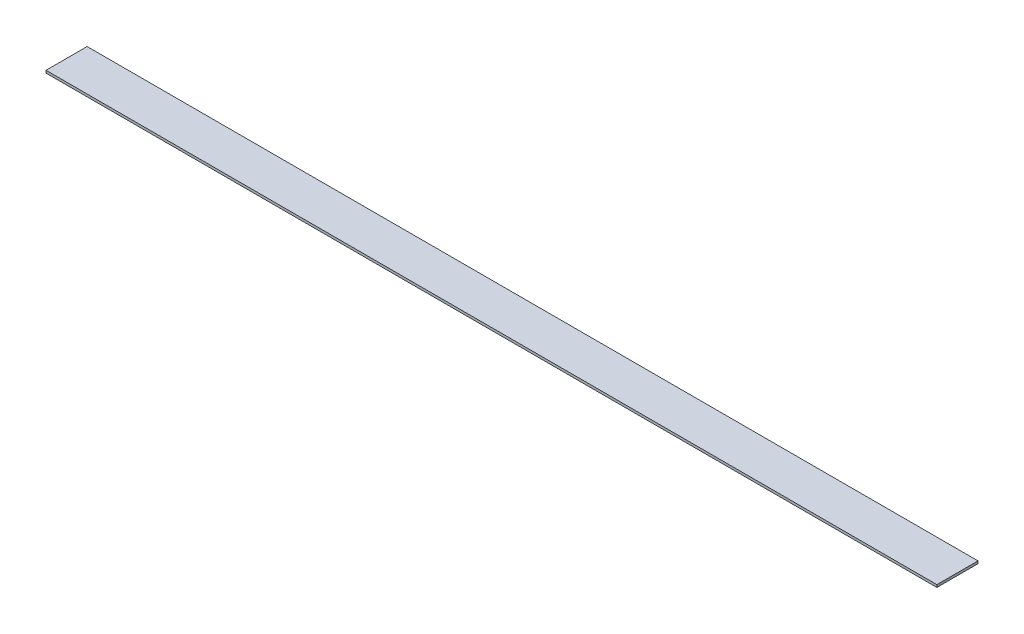
from build123d import *

# Parameters (mm, degrees)
SKETCH1_W           = 1083
SKETCH1_H           = 50
BOSS_EXTRUDE1_DEPTH = 3


with BuildPart() as part:
    # Sketch1 → Boss-Extrude1 (new body)
    with BuildSketch(Plane(origin=(0, 0, 0), x_dir=(1, 0, 0), z_dir=(0, 1, 0))):
        Rectangle(SKETCH1_W, SKETCH1_H)
    extrude(amount=BOSS_EXTRUDE1_DEPTH)


solid = part.part
